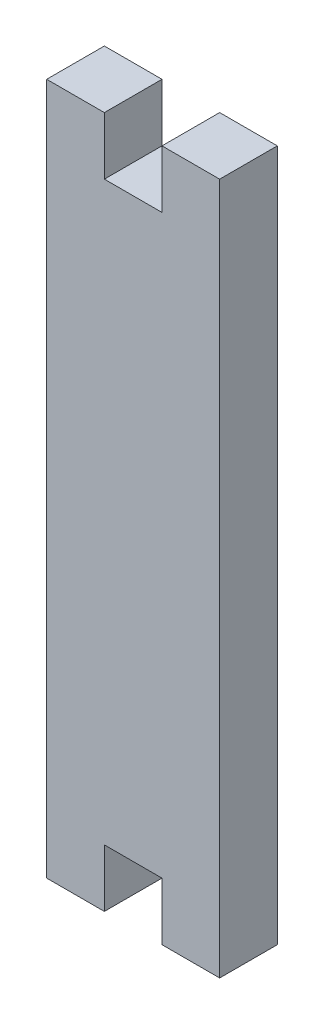
from build123d import *

# Parameters (mm, degrees)
BOSS_EXTRUDE2_DEPTH = 3


with BuildPart() as part:
    # Sketch1 → Boss-Extrude2 (new body)
    with BuildSketch(Plane.XY):
        Polygon((0.988883808, 17.726294389), (3.988883808, 17.726294389), (3.988883808, 14.726294389), (6.988883808, 14.726294389), (6.988883808, 17.726294389), (9.988883808, 17.726294389), (9.988883808, -18.273705611), (6.988883808, -18.273705611), (6.988883808, -15.273705611), (3.988883808, -15.273705611), (3.988883808, -18.273705611), (0.988883808, -18.273705611), align=None)
    extrude(amount=BOSS_EXTRUDE2_DEPTH)


solid = part.part
